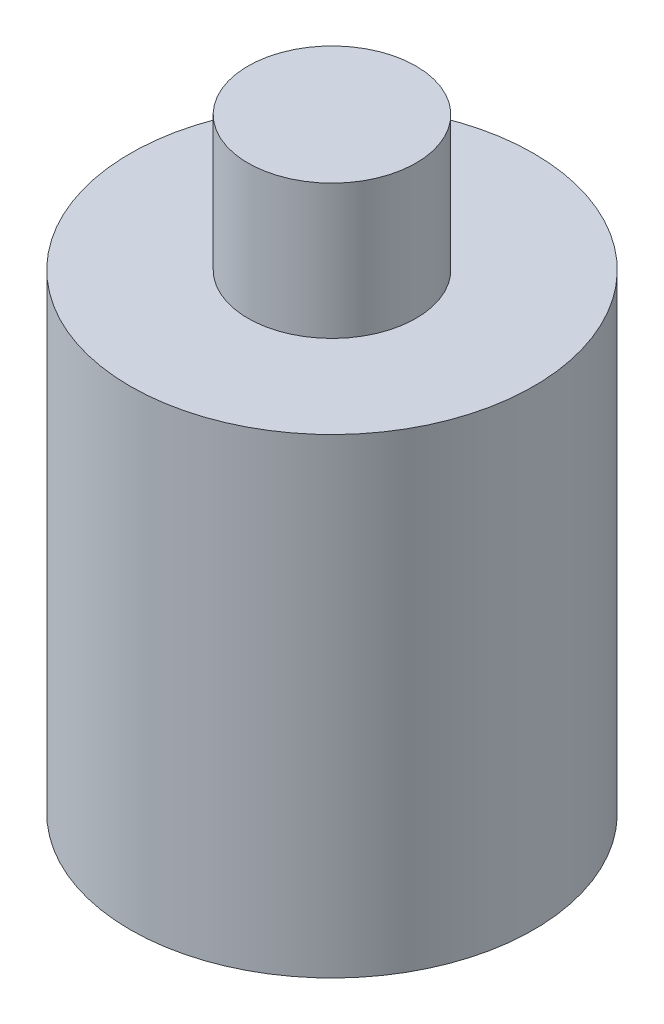
from build123d import *


with BuildPart() as part:
    # Esboço1 → Revolução1 (revolve)
    with BuildSketch(Plane.XY, mode=Mode.PRIVATE) as revolu_o1_sk:
        Polygon((0, 9), (0, 2.7), (1.6, 2.7), (1.6, 0), (3, 0), (3, 7), (1.25, 7), (1.25, 9), align=None)
    revolve(revolu_o1_sk.sketch.rotate(Axis((0, 0, 0), (0, 1, 0)), 90), axis=Axis((0, 0, 0), (0, 1, 0)))


solid = part.part
